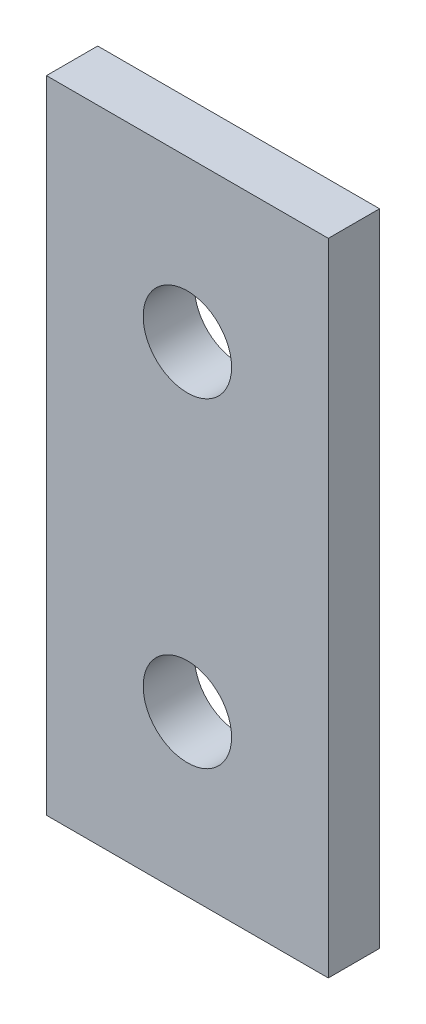
from build123d import *

# Parameters (mm, degrees)
SKETCH1_W      = 22
SKETCH1_H      = 50
SKETCH1_R      = 3.45
EXTRUDE1_DEPTH = 4


with BuildPart() as part:
    # Sketch1 → Extrude1 (new body)
    with BuildSketch(Plane.XY):
        with Locations((-13.733344788, -22.733780069)):
            Rectangle(SKETCH1_W, SKETCH1_H)
        with Locations((-13.733344788, -10.233780069)):
            Circle(SKETCH1_R, mode=Mode.SUBTRACT)
        with Locations((-13.733344788, -35.233780069)):
            Circle(SKETCH1_R, mode=Mode.SUBTRACT)
    extrude(amount=EXTRUDE1_DEPTH)


solid = part.part
